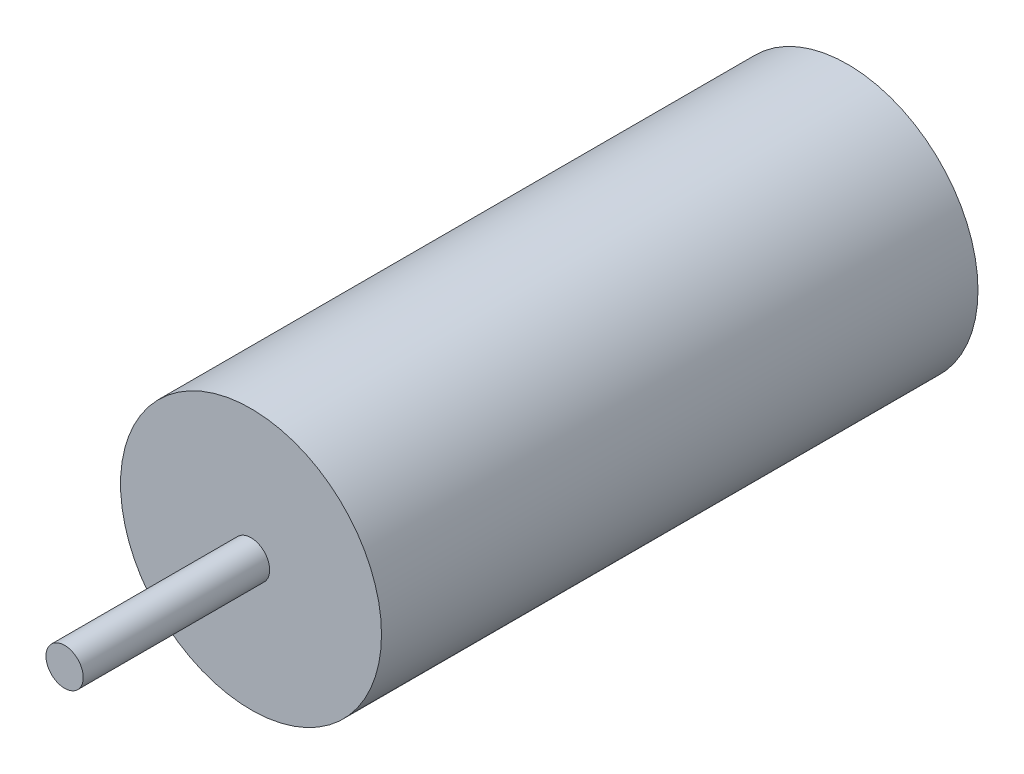
from build123d import *

# Parameters (mm, degrees)
SKETCH_1_R      = 3.5
EXTRUDE_1_DEPTH = 16
SKETCH_2_R      = 0.5
EXTRUDE_2_DEPTH = 5


with BuildPart() as part:
    # 草图1 → 凸台-拉伸1 (new body)
    with BuildSketch(Plane.XY):
        Circle(SKETCH_1_R)
    extrude(amount=EXTRUDE_1_DEPTH)

    # 草图2 → 凸台-拉伸2 (add)
    with BuildSketch(Plane.XY.offset(16)):
        Circle(SKETCH_2_R)
    extrude(amount=EXTRUDE_2_DEPTH)


solid = part.part
